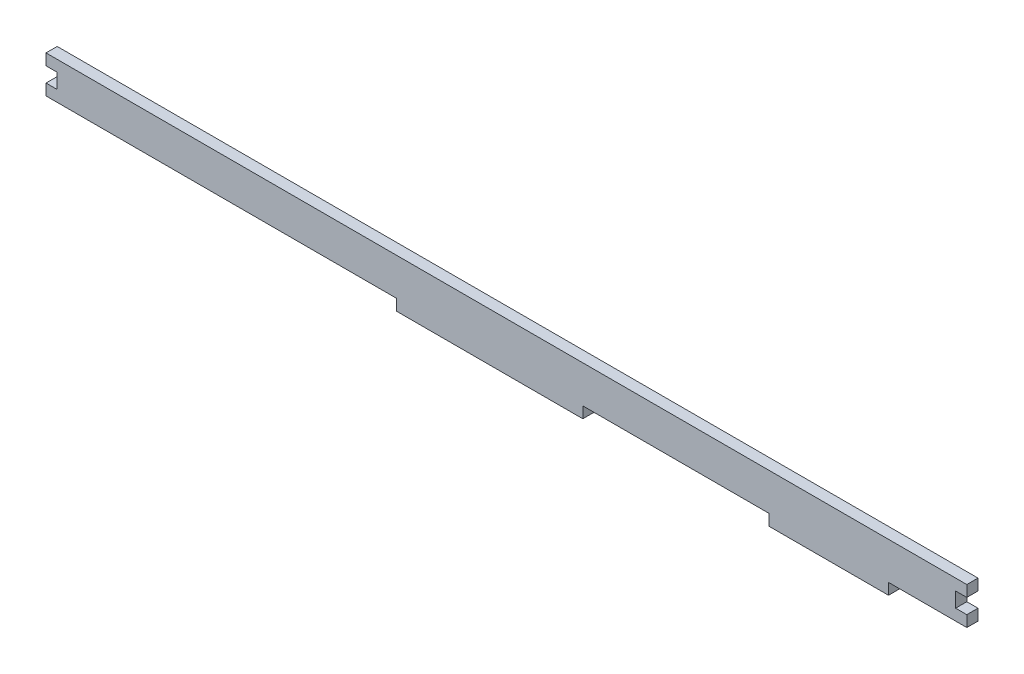
from build123d import *

# Parameters (mm, degrees)
BOSS_EXTRUDE1_DEPTH = 3


with BuildPart() as part:
    # Sketch1 → Boss-Extrude1 (new body)
    with BuildSketch(Plane.XY):
        Polygon((144, 0), (194, 0), (194, -3), (226, -3), (226, 0), (247, 0), (247, 3), (244, 3), (244, 7), (247, 7), (247, 10), (244, 10), (0, 10), (0, 7), (3, 7), (3, 3), (0, 3), (0, 0), (94, 0), (94, -3), (144, -3), align=None)
    extrude(amount=BOSS_EXTRUDE1_DEPTH)


solid = part.part
